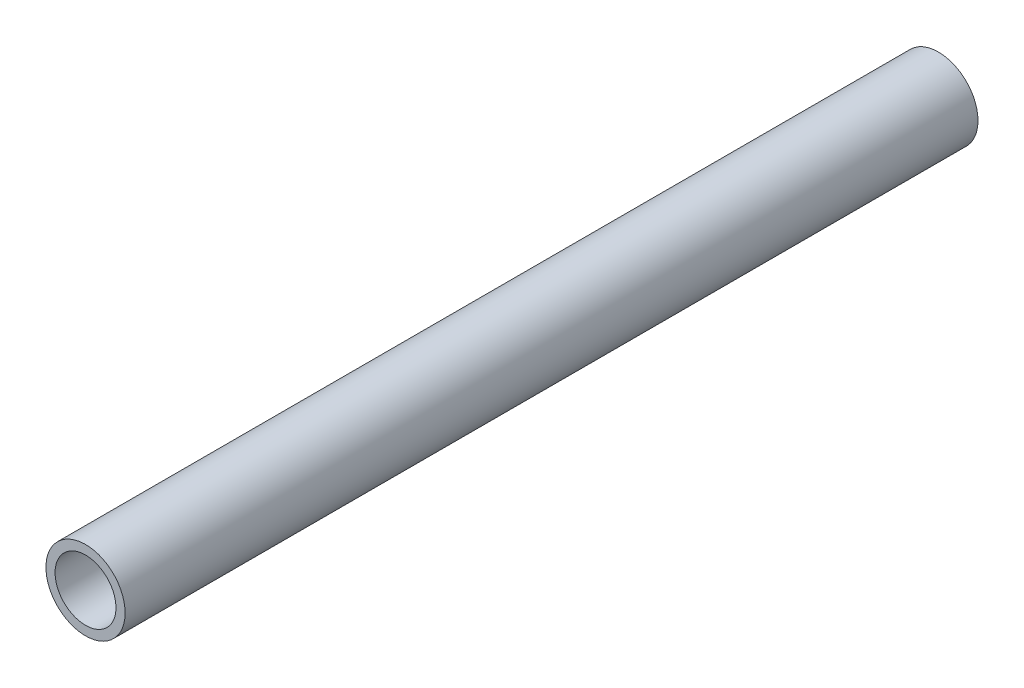
from build123d import *

# Parameters (mm, degrees)
SKETCH1_R           = 16.51
BOSS_EXTRUDE1_DEPTH = 355.6
SKETCH2_R           = 12.7
CUT_EXTRUDE1_DEPTH  = 355.6


with BuildPart() as part:
    # Sketch1 → Boss-Extrude1 (new body)
    with BuildSketch(Plane.XY):
        Circle(SKETCH1_R)
    extrude(amount=BOSS_EXTRUDE1_DEPTH)

    # Sketch2 → Cut-Extrude1 (cut)
    with BuildSketch(Plane(origin=(0, 0, 0), x_dir=(-1, 0, 0), z_dir=(0, 0, -1))):
        Circle(SKETCH2_R)
    extrude(amount=-CUT_EXTRUDE1_DEPTH, mode=Mode.SUBTRACT)


solid = part.part
